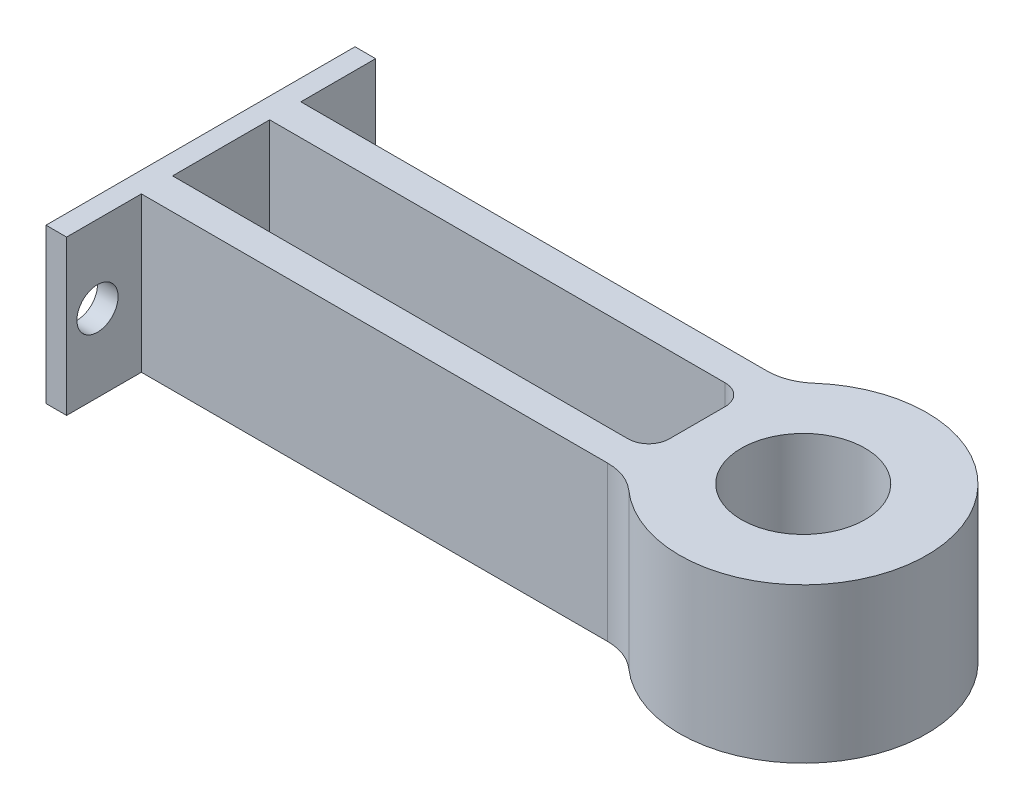
from build123d import *

# Parameters (mm, degrees)
EXTRUDE_1_DEPTH     = 15
SKETCH_4_W          = 1.562441002
SKETCH_4_H          = 15
SKETCH_4_W_2        = 6.177038061
EXTRUDE_3_DEPTH     = 5
SKETCH_2_R          = 6.01
CUT_EXTRUDE_2_DEPTH = 200
SKETCH_7_W          = 3.025917145
SKETCH_7_H          = 15
EXTRUDE_4_DEPTH     = 46.224
FILLET_1_R          = 2
FILLET_2_R          = 5
SKETCH_8_W          = 7.260520937
SKETCH_8_H          = 15
SKETCH_8_R          = 2
SKETCH_8_W_2        = 19.713561918
SKETCH_8_W_3        = 3.025917145
EXTRUDE_5_DEPTH     = 2


with BuildPart() as part:
    # 草图1 → 凸台-拉伸1 (new body)
    with BuildSketch(Plane(origin=(0, 0, 0), x_dir=(1, 0, 0), z_dir=(0, 1, 0))):
        with BuildLine():
            Line((-10.28806108, -6.177038061), (-10.28806108, 6.177038061))
            ThreePointArc((-10.28806108, 6.177038061), (12, 0), (-10.28806108, -6.177038061))
        make_face()
    extrude(amount=EXTRUDE_1_DEPTH)

    # 草图4 → 凸台-拉伸3 (add)
    with BuildSketch(Plane.ZY.offset(10.28806108)):
        with Locations((6.958258562, 7.5)):
            Rectangle(SKETCH_4_W, SKETCH_4_H)
        with Locations((-6.958258562, 7.5)):
            Rectangle(SKETCH_4_W, SKETCH_4_H)
        with Locations((-3.088519031, 7.5)):
            Rectangle(SKETCH_4_W_2, SKETCH_4_H)
        with Locations((3.088519031, 7.5)):
            Rectangle(SKETCH_4_W_2, SKETCH_4_H)
    extrude(amount=-EXTRUDE_3_DEPTH)

    # 草图2 → 切除-拉伸2 (cut)
    with BuildSketch(Plane(origin=(0, 15, 0), x_dir=(1, 0, 0), z_dir=(0, 1, 0))):
        with Locations(Location((0, 0, 0), (0, 0, 270))):
            Circle(SKETCH_2_R)
    extrude(amount=-CUT_EXTRUDE_2_DEPTH, mode=Mode.SUBTRACT)

    # 草图7 → 凸台-拉伸4 (add)
    with BuildSketch(Plane.ZY.offset(10.28806108)):
        with Locations((6.226520491, 7.5)):
            Rectangle(SKETCH_7_W, SKETCH_7_H)
        with Locations((-6.226520491, 7.5)):
            Rectangle(SKETCH_7_W, SKETCH_7_H)
    extrude(amount=EXTRUDE_4_DEPTH)

    # 圆角1
    fillet_1_edges = [part.edges().sort_by_distance(p)[0] for p in [
        (-10.28806108, 7.5, 4.713561918),
        (-10.28806108, 7.5, -4.713561918),
    ]]
    fillet(fillet_1_edges, radius=FILLET_1_R)

    # 圆角2
    fillet_2_edges = [part.edges().sort_by_distance(p)[0] for p in [
        (-9.170630504, 7.5, -7.739479063),
        (-9.170630504, 7.5, 7.739479063),
    ]]
    fillet(fillet_2_edges, radius=FILLET_2_R)

    # 草图8 → 凸台-拉伸5 (add)
    # profile 1 of 3: a face of its own
    with BuildSketch(Plane.ZY.offset(56.51206108)):
        with Locations((11.369739532, 7.5)):
            Rectangle(SKETCH_8_W, SKETCH_8_H)
        with Locations((12, 7.5)):
            Circle(SKETCH_8_R, mode=Mode.SUBTRACT)
    # profile 2 of 3: a face of its own
    with BuildSketch(Plane.ZY.offset(56.51206108)):
        with Locations((-5.143219041, 7.5)):
            Rectangle(SKETCH_8_W_2, SKETCH_8_H)
        with Locations((-12, 7.5)):
            Circle(SKETCH_8_R, mode=Mode.SUBTRACT)
    # profile 3 of 3: a face of its own
    with BuildSketch(Plane.ZY.offset(56.51206108)):
        with Locations((6.226520491, 7.5)):
            Rectangle(SKETCH_8_W_3, SKETCH_8_H)
    extrude(amount=EXTRUDE_5_DEPTH)


solid = part.part
